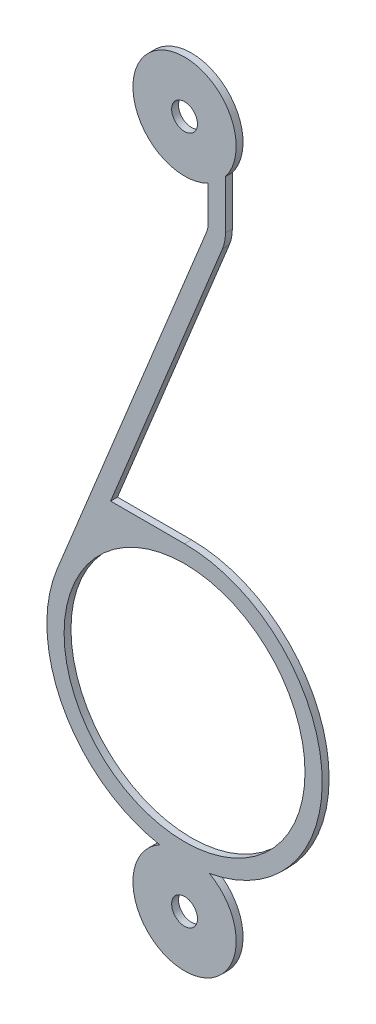
from build123d import *

# Parameters (mm, degrees)
SKETCH1_R           = 0.375
SKETCH1_R_2         = 3.5
BOSS_EXTRUDE1_DEPTH = 0.1


with BuildPart() as part:
    # Sketch1 → Boss-Extrude1 (new, symmetric)
    with BuildSketch(Plane.XY):
        with BuildLine():
            Line((0.636628274, 7.407290054), (-3.704019046, -3.239952681))
            ThreePointArc((-3.704019046, -3.239952681), (-3.507926477, -6.672095687), (-0.720779018, -8.68452381))
            ThreePointArc((-0.720779018, -8.68452381), (0, -11.5), (0.720779018, -8.68452381))
            ThreePointArc((0.720779018, -8.68452381), (3.983597321, -4.388126568), (0, -0.75))
            Line((0, -0.75), (-2.148965927, -0.75))
            Line((-2.148965927, -0.75), (1.099630654, 7.218534139))
            ThreePointArc((1.099630654, 7.218534139), (1.165325631, 7.4384166), (1.1875, 7.666829437))
            Line((1.1875, 7.666829437), (1.1875, 9.083570106))
            ThreePointArc((1.1875, 9.083570106), (-0.960377242, 11.152248043), (0.6875, 8.666829437))
            Line((0.6875, 8.666829437), (0.6875, 7.666829437))
            ThreePointArc((0.6875, 7.666829437), (0.674662207, 7.534590426), (0.636628274, 7.407290054))
        make_face()
        with Locations((0, 10)):
            Circle(SKETCH1_R, mode=Mode.SUBTRACT)
        with Locations((0, -10)):
            Circle(SKETCH1_R, mode=Mode.SUBTRACT)
        with Locations((0, -4.75)):
            Circle(SKETCH1_R_2, mode=Mode.SUBTRACT)
    extrude(amount=BOSS_EXTRUDE1_DEPTH, both=True)


solid = part.part
